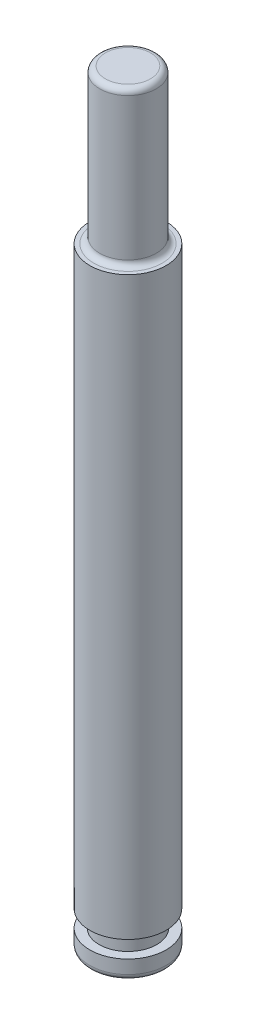
from build123d import *

# Parameters (mm, degrees)
FILLET1_R = 0.15


with BuildPart() as part:
    # Sketch1 → Revolve1 (revolve)
    with BuildSketch(Plane.XY):
        Polygon((0, 19.9), (-0.735, 19.9), (-0.735, 15.9), (-0.99, 15.9), (-0.99, 0.94), (-0.75, 0.94), (-0.75, 0.5), (-0.99, 0.5), (-0.99, 0), (0, 0), align=None)
    revolve(axis=Axis((0, 19.9, 0), (0, -1, 0)))

    # Fillet1
    fillet1_edges = [part.edges().sort_by_distance(p)[0] for p in [
        (0.735, 15.9, 0),
        (0.735, 19.9, 0),
        (0.99, 0, 0),
    ]]
    fillet(fillet1_edges, radius=FILLET1_R)


solid = part.part
